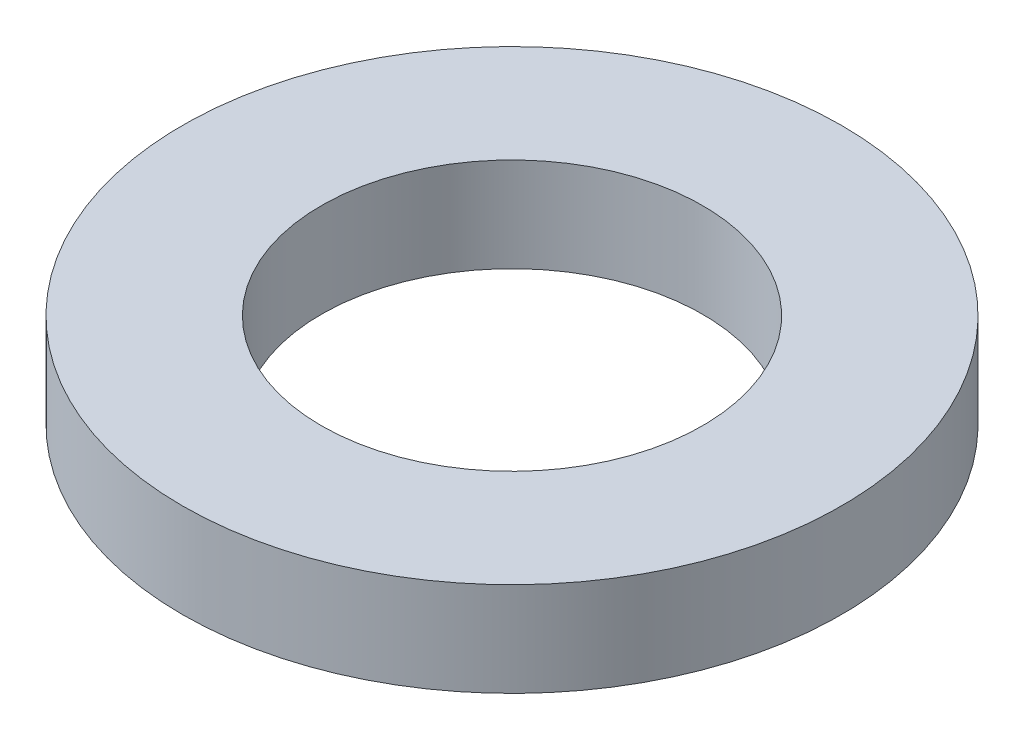
from build123d import *

# Parameters (mm, degrees)
SKETCH1_R           = 7
SKETCH1_R_2         = 4.05
BOSS_EXTRUDE1_DEPTH = 2


with BuildPart() as part:
    # Sketch1 → Boss-Extrude1 (new body)
    with BuildSketch(Plane(origin=(0, 0, 0), x_dir=(1, 0, 0), z_dir=(0, 1, 0))):
        with Locations(Location((0, 0, 0), (0, 0, 270))):
            Circle(SKETCH1_R)
        with Locations(Location((0, 0, 0), (0, 0, 270))):
            Circle(SKETCH1_R_2, mode=Mode.SUBTRACT)
    extrude(amount=BOSS_EXTRUDE1_DEPTH)


solid = part.part
